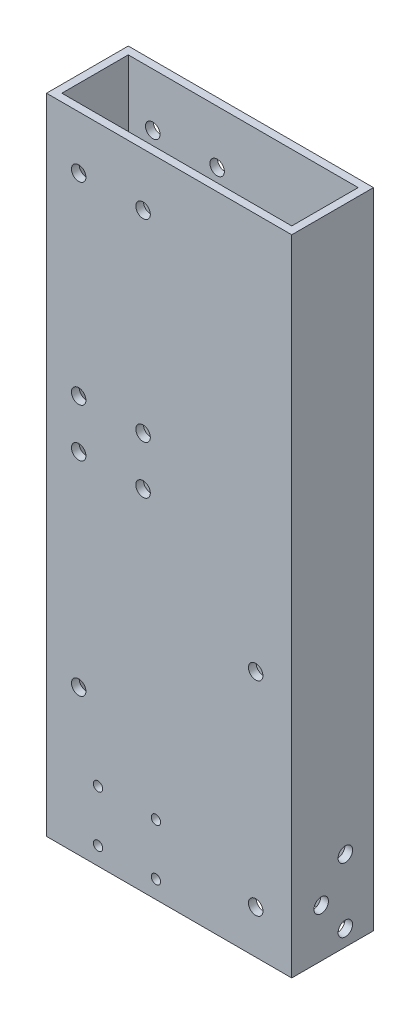
from build123d import *

# Parameters (mm, degrees)
SKETCH1_W                      = 152.4
SKETCH1_H                      = 50.8
SKETCH1_W_2                    = 142.875
SKETCH1_H_2                    = 41.275
EXTRUDE_THIN1_DEPTH            = 400
M8_CLEARANCE_HOLE1_D           = 9
M8_CLEARANCE_HOLE2_D           = 9
M5_CLEARANCE_HOLE1_D           = 5.8
M8_CLEARANCE_HOLE3_D           = 9
M8_CLEARANCE_HOLE3_DEPTH       = 4.7625
F_20_0_20_DIAMETER_HOLE1_D     = 20
F_20_0_20_DIAMETER_HOLE1_DEPTH = 4.7625


with BuildPart() as part:
    # Sketch1 → Extrude-Thin1 (new body)
    with BuildSketch(Plane(origin=(0, 0, 0), x_dir=(1, 0, 0), z_dir=(0, 1, 0))):
        Rectangle(SKETCH1_W, SKETCH1_H)
        Rectangle(SKETCH1_W_2, SKETCH1_H_2, mode=Mode.SUBTRACT)
    extrude(amount=EXTRUDE_THIN1_DEPTH)

    # M8 Clearance Hole1 (through all)
    with Locations(Plane.XY.offset(25.4)):
        with Locations((53.8, 153.666666667), (-56.2, 217), (-16.2, 217), (-56.2, 90.333333333), (53.8, 27)):
            Hole(M8_CLEARANCE_HOLE1_D / 2)

    # M8 Clearance Hole2 (through all)
    with Locations(Plane.XY.offset(25.4)):
        with Locations((-56.2, 367), (-16.2, 247), (-56.2, 247), (-16.2, 367)):
            Hole(M8_CLEARANCE_HOLE2_D / 2)

    # M5 Clearance Hole1 (through all)
    with Locations(Plane.XY.offset(25.4)):
        with Locations((-44.2, 11), (-8.2, 43), (-8.2, 11), (-44.2, 43)):
            Hole(M5_CLEARANCE_HOLE1_D / 2)

    # M8 Clearance Hole3
    with Locations(Plane(origin=(76.2, 0, 0), x_dir=(0, 0, -1), z_dir=(1, 0, 0))):
        with Locations((-7.9, 50), (-7.9, 10), (7.1, 30)):
            Hole(M8_CLEARANCE_HOLE3_D / 2, depth=M8_CLEARANCE_HOLE3_DEPTH)

    # Ø20.0 (20) Diameter Hole1
    with Locations(Plane.ZY.offset(76.2)):
        with Locations((0.4, 40)):
            Hole(F_20_0_20_DIAMETER_HOLE1_D / 2, depth=F_20_0_20_DIAMETER_HOLE1_DEPTH)


with BuildPart() as body_2:
    # Mirror1: mirrored copy
    add(part.part.mirror(Plane.XY))


solid = body_2.part
